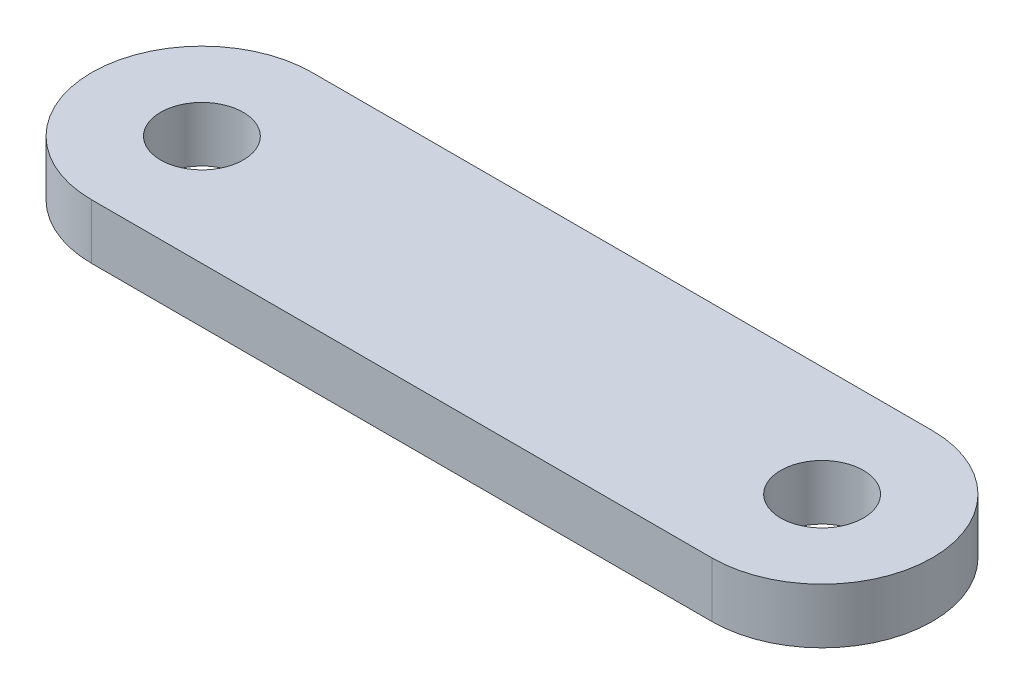
from build123d import *

# Parameters (mm, degrees)
SKETCH1_R           = 1.905
BOSS_EXTRUDE1_DEPTH = 2.54


with BuildPart() as part:
    # Sketch1 → Boss-Extrude1 (new body)
    with BuildSketch(Plane(origin=(0, 0, 0), x_dir=(1, 0, 0), z_dir=(0, 1, 0))):
        with BuildLine():
            Line((-14.2875, 5.08), (14.2875, 5.08))
            ThreePointArc((14.2875, 5.08), (19.3675, 0), (14.2875, -5.08))
            Line((14.2875, -5.08), (-14.2875, -5.08))
            ThreePointArc((-14.2875, -5.08), (-19.3675, 0), (-14.2875, 5.08))
        make_face()
        with Locations(Location((-14.2875, 0, 0), (0, 0, 270))):
            Circle(SKETCH1_R, mode=Mode.SUBTRACT)
        with Locations(Location((14.2875, 0, 0), (0, 0, 270))):
            Circle(SKETCH1_R, mode=Mode.SUBTRACT)
    extrude(amount=BOSS_EXTRUDE1_DEPTH)


solid = part.part
